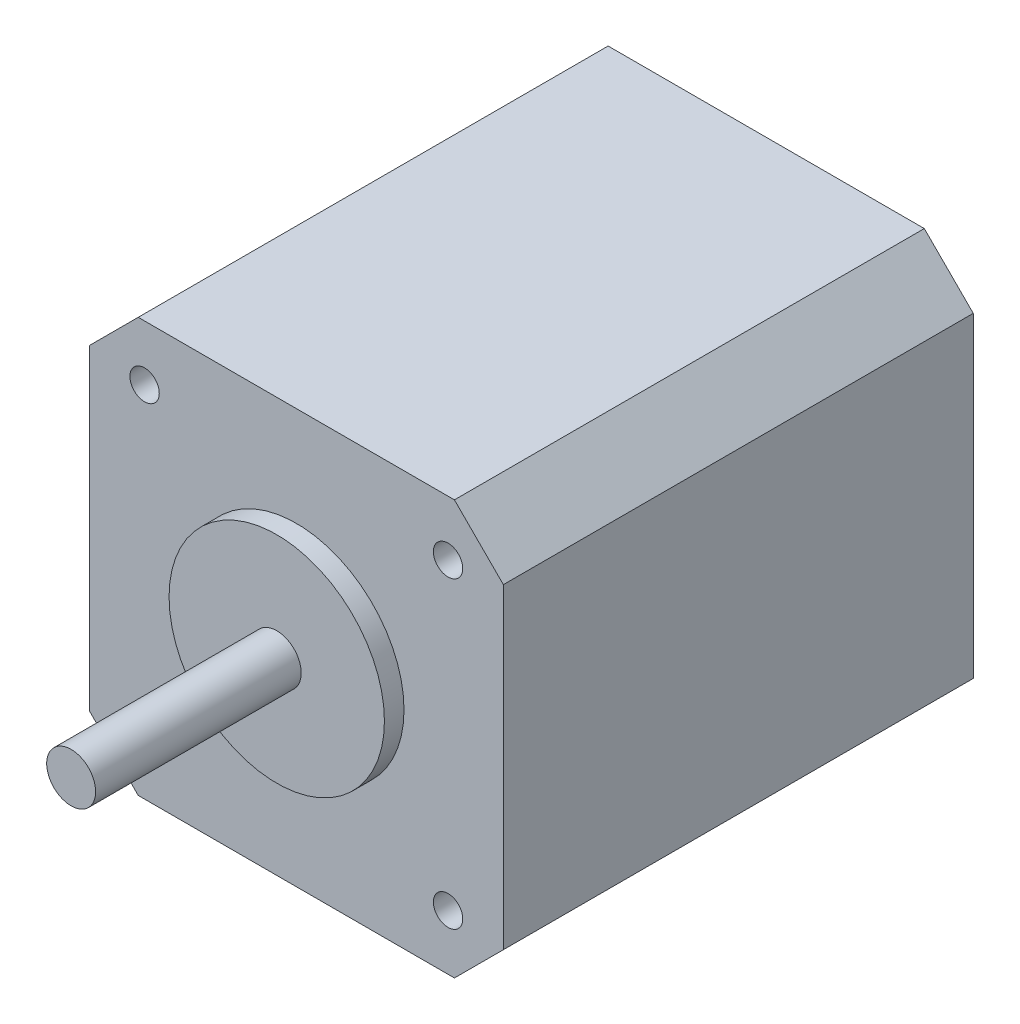
from build123d import *

# Parameters (mm, degrees)
SKETCH1_W           = 42.3
SKETCH1_H           = 42.3
BOSS_EXTRUDE1_DEPTH = 48
CHAMFER1_SIZE       = 5
SKETCH3_R           = 1.5
CUT_EXTRUDE1_DEPTH  = 5
SKETCH4_R           = 11
BOSS_EXTRUDE2_DEPTH = 2
SKETCH5_R           = 2.5
BOSS_EXTRUDE3_DEPTH = 23
SKETCH6_W           = 16
SKETCH6_H           = 7
BOSS_EXTRUDE4_DEPTH = 9.6


with BuildPart() as part:
    # Sketch1 → Boss-Extrude1 (new body)
    with BuildSketch(Plane.XY):
        Rectangle(SKETCH1_W, SKETCH1_H)
    extrude(amount=-BOSS_EXTRUDE1_DEPTH)

    # Chamfer1
    chamfer1_edges = [part.edges().sort_by_distance(p)[0] for p in [
        (21.15, -21.15, -24),
        (-21.15, -21.15, -24),
        (-21.15, 21.15, -24),
        (21.15, 21.15, -24),
    ]]
    chamfer(chamfer1_edges, length=CHAMFER1_SIZE)

    # Sketch3 → Cut-Extrude1 (cut)
    with BuildSketch(Plane.XY):
        with Locations((15.5, -15.5)):
            Circle(SKETCH3_R)
        with Locations((-15.5, -15.5)):
            Circle(SKETCH3_R)
        with Locations((-15.5, 15.5)):
            Circle(SKETCH3_R)
        with Locations((15.5, 15.5)):
            Circle(SKETCH3_R)
    extrude(amount=-CUT_EXTRUDE1_DEPTH, mode=Mode.SUBTRACT)

    # Sketch4 → Boss-Extrude2 (add)
    with BuildSketch(Plane.XY):
        Circle(SKETCH4_R)
    extrude(amount=BOSS_EXTRUDE2_DEPTH)

    # Sketch5 → Boss-Extrude3 (add)
    with BuildSketch(Plane.XY):
        Circle(SKETCH5_R)
    extrude(amount=BOSS_EXTRUDE3_DEPTH)

    # Sketch6 → Boss-Extrude4 (add)
    with BuildSketch(Plane(origin=(0, 0, -48), x_dir=(-1, 0, 0), z_dir=(0, 0, -1))):
        with Locations((0, -24.65)):
            Rectangle(SKETCH6_W, SKETCH6_H)
    extrude(amount=-BOSS_EXTRUDE4_DEPTH)


solid = part.part
